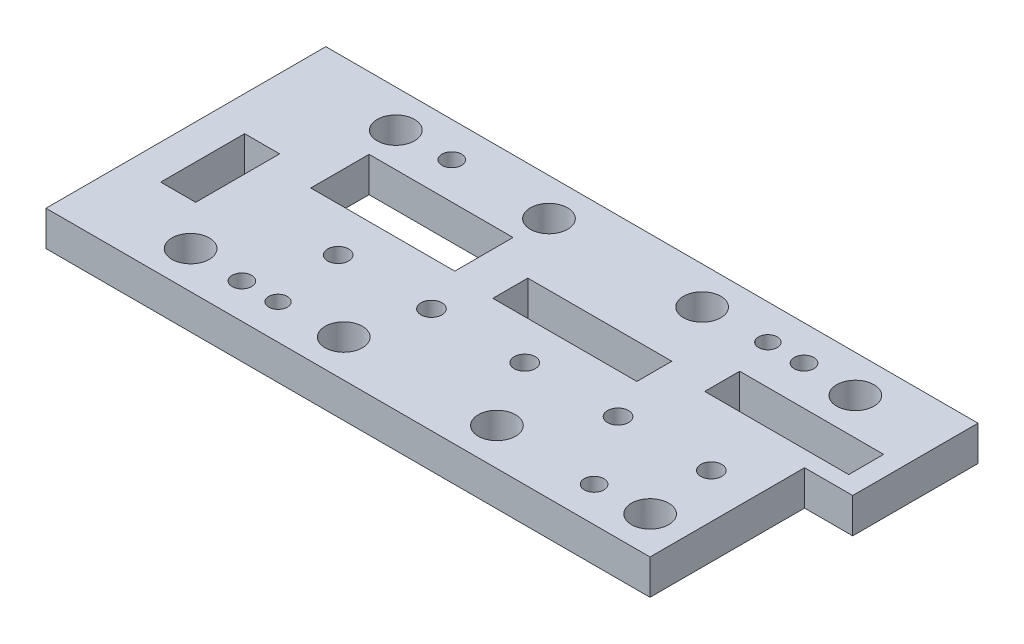
from build123d import *

# Parameters (mm, degrees)
SKETCH1_W                                           = 229
SKETCH1_H                                           = 120
BOSS_EXTRUDE1_DEPTH                                 = 7.5
SKETCH4_W                                           = 20.632503002
SKETCH4_H                                           = 53.730004003
BOSS_EXTRUDE2_DEPTH                                 = 15
CUT_EXTRUDE1_REACH                                  = 239.205
SKETCH5_W                                           = 61.75
SKETCH5_H                                           = 15
SKETCH5_H_2                                         = 25
CUT_EXTRUDE4_REACH                                  = 239.205
SKETCH8_R                                           = 8
LPATTERN2_COUNT                                     = 4
LPATTERN2_PITCH                                     = 65.677
LPATTERN2_COUNT_DIR2                                = 2
LPATTERN2_PITCH_DIR2                                = 88
F_9_0_9_DIAMETER_HOLE1_D                            = 9
CBORE_FOR_M8_HEX_SOCKET_HEAD_CAP_SCREW1_D           = 8.4
CBORE_FOR_M8_HEX_SOCKET_HEAD_CAP_SCREW1_CBORE_D     = 15
CBORE_FOR_M8_HEX_SOCKET_HEAD_CAP_SCREW1_CBORE_DEPTH = 8.6
F_8_0MM_DOWEL_HOLE1_D                               = 8
SKETCH18_W                                          = 120
SKETCH18_H                                          = 15
BOSS_EXTRUDE3_DEPTH                                 = 30
CUT_EXTRUDE5_REACH                                  = 268.282
SKETCH19_W                                          = 15
SKETCH19_H                                          = 36


with BuildPart() as part:
    # Sketch1 → Boss-Extrude1 (new, symmetric)
    with BuildSketch(Plane(origin=(0, 0, 0), x_dir=(1, 0, 0), z_dir=(0, 1, 0))):
        with Locations((-114.5, 0)):
            Rectangle(SKETCH1_W, SKETCH1_H)
    extrude(amount=BOSS_EXTRUDE1_DEPTH, both=True)

    # Sketch4 → Boss-Extrude2 (add)
    with BuildSketch(Plane(origin=(0, 7.5, 0), x_dir=(1, 0, 0), z_dir=(0, 1, 0))):
        with Locations((10.316251501, 33.134997999)):
            Rectangle(SKETCH4_W, SKETCH4_H)
    extrude(amount=-BOSS_EXTRUDE2_DEPTH)

    # Sketch5 → Cut-Extrude1 (cut, up to next)
    with BuildSketch(Plane(origin=(0, 7.5, 0), x_dir=(1, 0, 0), z_dir=(0, 1, 0)), mode=Mode.PRIVATE) as cut_extrude1_sk1:
        with Locations((-98.875, 9.852366083)):
            Rectangle(SKETCH5_W, SKETCH5_H)
    cut_extrude1_tool1 = extrude(cut_extrude1_sk1.sketch, amount=-CUT_EXTRUDE1_REACH, mode=Mode.PRIVATE) & part.part
    # Sketch5 → Cut-Extrude1 (cut, up to next)
    with BuildSketch(Plane(origin=(0, 7.5, 0), x_dir=(1, 0, 0), z_dir=(0, 1, 0)), mode=Mode.PRIVATE) as cut_extrude1_sk2:
        with Locations((-18.875, 20.69101)):
            Rectangle(SKETCH5_W, SKETCH5_H)
    cut_extrude1_tool2 = extrude(cut_extrude1_sk2.sketch, amount=-CUT_EXTRUDE1_REACH, mode=Mode.PRIVATE) & part.part
    # Sketch5 → Cut-Extrude1 (cut, up to next)
    with BuildSketch(Plane(origin=(0, 7.5, 0), x_dir=(1, 0, 0), z_dir=(0, 1, 0)), mode=Mode.PRIVATE) as cut_extrude1_sk3:
        with Locations((-178.875, 16.78)):
            Rectangle(SKETCH5_W, SKETCH5_H_2)
    cut_extrude1_tool3 = extrude(cut_extrude1_sk3.sketch, amount=-CUT_EXTRUDE1_REACH, mode=Mode.PRIVATE) & part.part
    add(cut_extrude1_tool1.solids().sort_by_distance((-98.875, 7.5, -9.852366))[0], mode=Mode.SUBTRACT)
    add(cut_extrude1_tool2.solids().sort_by_distance((-18.875, 7.5, -20.69101))[0], mode=Mode.SUBTRACT)
    add(cut_extrude1_tool3.solids().sort_by_distance((-178.875, 7.5, -16.78))[0], mode=Mode.SUBTRACT)

    # Sketch8 → Cut-Extrude4 (cut, up to next)
    with BuildSketch(Plane(origin=(0, 7.5, 0), x_dir=(1, 0, 0), z_dir=(0, 1, 0)), mode=Mode.PRIVATE) as cut_extrude4_sk1:
        with Locations(Location((-213, 44, 0), (0, 0, 270))):
            Circle(SKETCH8_R)
    cut_extrude4_tool1 = extrude(cut_extrude4_sk1.sketch, amount=-CUT_EXTRUDE4_REACH, mode=Mode.PRIVATE) & part.part
    cut_extrude4 = cut_extrude4_tool1.solids().sort_by_distance((-213, 7.5, -44))[0]
    add(cut_extrude4, mode=Mode.SUBTRACT)

    # LPattern2: Cut-Extrude4 4 × 2
    with Locations(*[(i * LPATTERN2_PITCH, 0, j * LPATTERN2_PITCH_DIR2) for i in range(LPATTERN2_COUNT) for j in range(LPATTERN2_COUNT_DIR2) if (i, j) != (0, 0)]):
        add(cut_extrude4, mode=Mode.SUBTRACT)

    # Ø9.0 (9) Diameter Hole1 (through all)
    with Locations(Plane(origin=(0, 7.5, 0), x_dir=(1, 0, 0), z_dir=(0, 1, 0))):
        with Locations((-179, -14.72), (-139, -14.72), (-99, -14.72), (-59, -14.72), (-19, -14.72)):
            Hole(F_9_0_9_DIAMETER_HOLE1_D / 2)

    # CBORE for M8 Hex Socket Head Cap Screw1 (through all)
    with Locations(Plane(origin=(0, -7.5, 0), x_dir=(-1, 0, 0), z_dir=(0, -1, 0))):
        with Locations((38.969, 45), (190, 45), (190, -45), (38.969, -45)):
            CounterBoreHole(CBORE_FOR_M8_HEX_SOCKET_HEAD_CAP_SCREW1_D / 2, CBORE_FOR_M8_HEX_SOCKET_HEAD_CAP_SCREW1_CBORE_D / 2, CBORE_FOR_M8_HEX_SOCKET_HEAD_CAP_SCREW1_CBORE_DEPTH)

    # Ø8.0mm Dowel Hole1 (through all)
    with Locations(Plane(origin=(0, -7.5, 0), x_dir=(-1, 0, 0), z_dir=(0, -1, 0))):
        with Locations((174.5, -45), (54.469, 45)):
            Hole(F_8_0MM_DOWEL_HOLE1_D / 2)

    # Sketch18 → Boss-Extrude3 (add)
    with BuildSketch(Plane.ZY.offset(229)):
        Rectangle(SKETCH18_W, SKETCH18_H)
    extrude(amount=BOSS_EXTRUDE3_DEPTH)

    # Sketch19 → Cut-Extrude5 (cut, up to next)
    with BuildSketch(Plane(origin=(0, 7.5, 0), x_dir=(1, 0, 0), z_dir=(0, 1, 0)), mode=Mode.PRIVATE) as cut_extrude5_sk1:
        with Locations((-236.6, -7.72)):
            Rectangle(SKETCH19_W, SKETCH19_H)
    cut_extrude5_tool1 = extrude(cut_extrude5_sk1.sketch, amount=-CUT_EXTRUDE5_REACH, mode=Mode.PRIVATE) & part.part
    add(cut_extrude5_tool1.solids().sort_by_distance((-236.6, 7.5, 7.72))[0], mode=Mode.SUBTRACT)


solid = part.part
